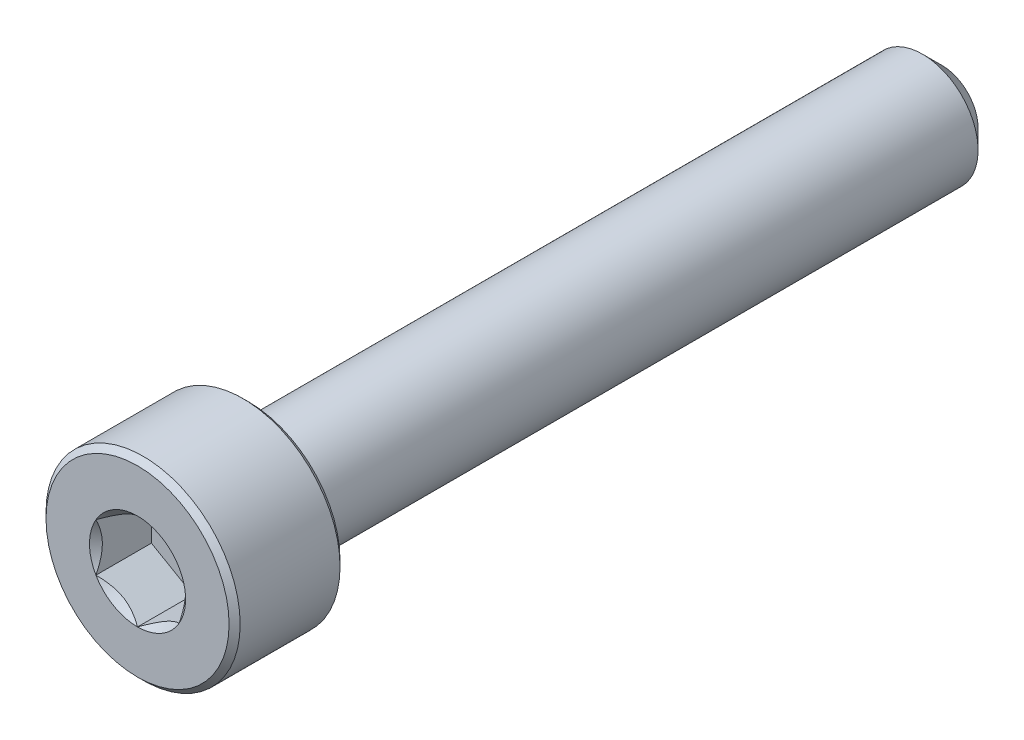
from build123d import *

# Parameters (mm, degrees)
CUT_EXTRUDE1_START = -2
CUT_EXTRUDE1_DEPTH = 2
SKETCH4_R          = 1.732050808
CUT_EXTRUDE2_DEPTH = 0.5
CUT_EXTRUDE2_DRAFT = -45


with BuildPart() as part:
    # Sketch2 → Revolve1 (revolve)
    with BuildSketch(Plane(origin=(0, 0, 0), x_dir=(0, 0, -1), z_dir=(1, 0, 0)), mode=Mode.PRIVATE) as revolve1_sk:
        Polygon((-14.3, 3.5), (-10.7, 3.5), (-10.5, 3.3), (-10.5, 2), (13.8, 2), (14.5, 1.3), (14.5, 0), (-14.5, 0), (-14.5, 3.3), align=None)
    revolve(revolve1_sk.sketch.rotate(Axis((0, 0, -14.5), (0, 0, 1)), 90), axis=Axis((0, 0, -14.5), (0, 0, 1)))

    # Sketch3 → Cut-Extrude1 (cut)
    with BuildSketch(Plane.XY.offset(14.5).offset(CUT_EXTRUDE1_START)):
        Polygon((0, 1.732050808), (-1.5, 0.866025404), (-1.5, -0.866025404), (0, -1.732050808), (1.5, -0.866025404), (1.5, 0.866025404), align=None)
    extrude(amount=CUT_EXTRUDE1_DEPTH, mode=Mode.SUBTRACT)


with BuildPart() as cut_extrude2_tool:
    # Sketch4 → Cut-Extrude2 (with draft: the straight prism first)
    with BuildSketch(Plane.XY.offset(14.5)):
        Circle(SKETCH4_R)
    extrude(amount=-CUT_EXTRUDE2_DEPTH)
    # Cut-Extrude2: the draft: its side faces are tilted about the plane it starts from
    cut_extrude2_sides = [cut_extrude2_tool.faces().sort_by_distance(p)[0] for p in [
        (-1.732050808, 0, 14.25),
    ]]
    draft(cut_extrude2_sides, Plane.XY.offset(14.5), CUT_EXTRUDE2_DRAFT)


with BuildPart() as part_1:
    add(part.part)

    # Cut-Extrude2: cut by cut_extrude2_tool
    add(cut_extrude2_tool.part, mode=Mode.SUBTRACT)


solid = part_1.part
